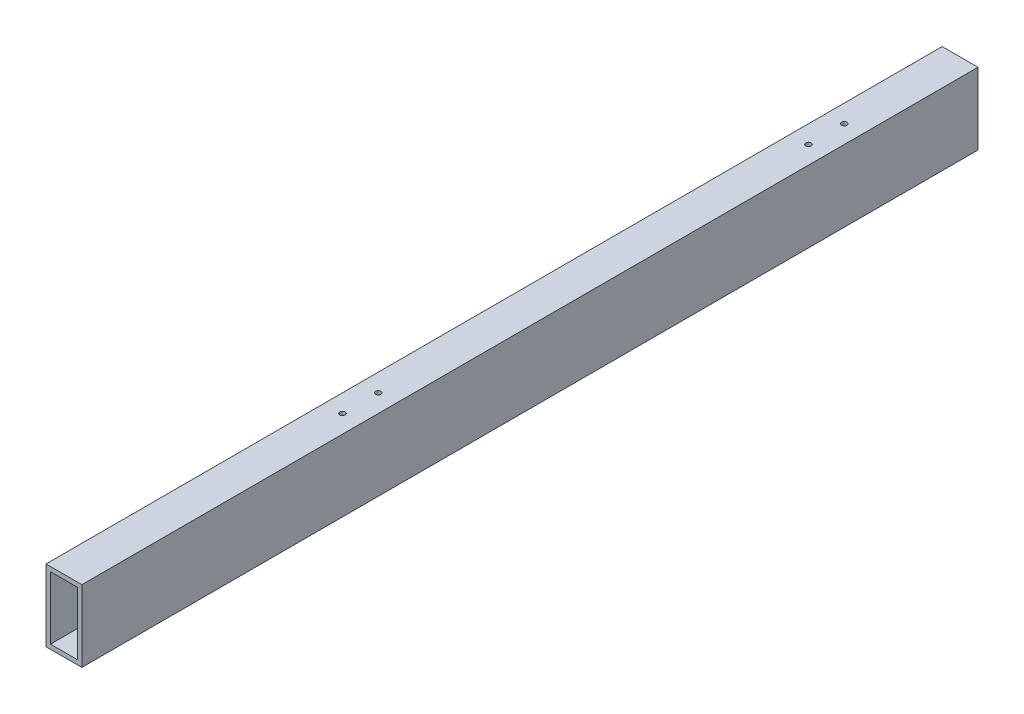
from build123d import *

# Parameters (mm, degrees)
SKETCH1_W           = 25.4
SKETCH1_H           = 50.8
SKETCH1_W_2         = 19.05
SKETCH1_H_2         = 44.45
BOSS_EXTRUDE1_DEPTH = 317.5
SKETCH2_R           = 1.905
CUT_EXTRUDE1_DEPTH  = 322.789030267


with BuildPart() as part:
    # Sketch1 → Boss-Extrude1 (new, symmetric)
    with BuildSketch(Plane.XY):
        Rectangle(SKETCH1_W, SKETCH1_H)
        Rectangle(SKETCH1_W_2, SKETCH1_H_2, mode=Mode.SUBTRACT)
    extrude(amount=BOSS_EXTRUDE1_DEPTH, both=True)

    # Sketch2 → Cut-Extrude1 (cut, through all)
    with BuildSketch(Plane(origin=(0, 25.4, 0), x_dir=(1, 0, 0), z_dir=(0, 1, 0))):
        with Locations(Location((0, -120.1166, 0), (0, 0, 270))):
            Circle(SKETCH2_R)
        with Locations(Location((0, -94.7166, 0), (0, 0, 270))):
            Circle(SKETCH2_R)
        with Locations(Location((0, 235.48594, 0), (0, 0, 270))):
            Circle(SKETCH2_R)
        with Locations(Location((0, 210.08594, 0), (0, 0, 270))):
            Circle(SKETCH2_R)
    extrude(amount=-CUT_EXTRUDE1_DEPTH, mode=Mode.SUBTRACT)


solid = part.part
